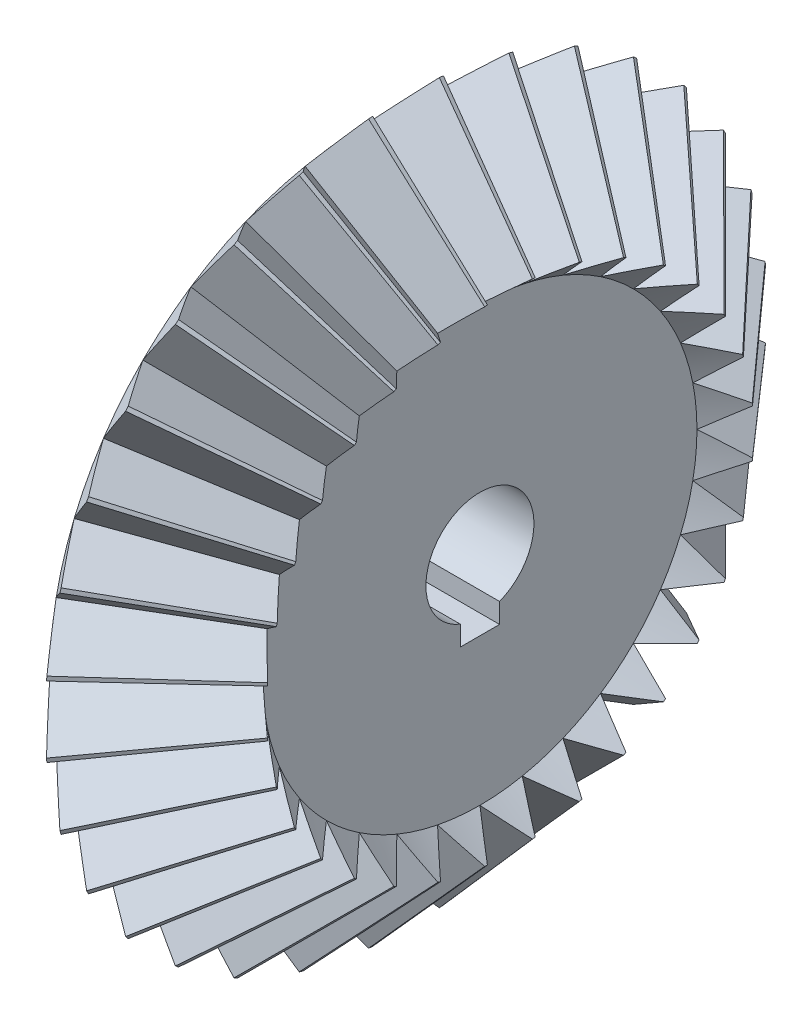
from build123d import *
from build123d.topology import SkipClean

# Parameters (mm, degrees)
SKETCH8_W           = 13.584392644
SKETCH8_H           = 13.584392644
CUT_EXTRUDE3_DEPTH  = 140.683118778
CIRPATTERN2_COUNT   = 32
SKETCH5_R           = 20
BOSS_EXTRUDE2_DEPTH = 12
CUT_EXTRUDE1_DEPTH  = 35


with BuildPart() as part:
    # Sketch1 → Revolve1 (revolve)
    with BuildSketch(Plane(origin=(0, 0, 0), x_dir=(1, 0, 0), z_dir=(0, 1, 0)), mode=Mode.PRIVATE) as revolve1_sk:
        Polygon((0, 0), (23, 0), (23, 44.199151966), (29.109392267, 49.604779092), (7.947696669, 73.521541461), (0, 64.53076187), align=None)
    revolve(revolve1_sk.sketch.rotate(Axis((23, 0, 0), (1, 0, 0)), 180), axis=Axis((23, 0, 0), (1, 0, 0)))

    # Sketch8 → Cut-Extrude3 (cut, through all)
    with SkipClean():  # the faces are left unmerged after this step: merging them gives an invalid solid
        with BuildSketch(Plane(origin=(-32.021593131, 0, -28.30654522), x_dir=(-0.6623080557420813, 0, 0.7492316326071291), z_dir=(-0.7492316326071291, 0, -0.6623080557420813))):
            Polygon((-60.112917194, 6.792196322), (-48.348488069, 0), (-60.112917194, -6.792196322), align=None)
            with Locations((-66.905113516, 0)):
                Rectangle(SKETCH8_W, SKETCH8_H)
        cut_extrude3 = extrude(amount=-CUT_EXTRUDE3_DEPTH, mode=Mode.SUBTRACT)

    # CirPattern2: Cut-Extrude3 ×32 about axis
    cirpattern2_axis = Axis((0, 0, 0), (1, 0, 0))
    for i in range(1, CIRPATTERN2_COUNT):
        add(cut_extrude3.rotate(cirpattern2_axis, i * 360 / CIRPATTERN2_COUNT), mode=Mode.SUBTRACT)

    # Sketch5 → Boss-Extrude2 (add)
    with BuildSketch(Plane.ZY):
        with Locations(Location((0, 0, 0), (0, 0, 180))):
            Circle(SKETCH5_R)
    extrude(amount=BOSS_EXTRUDE2_DEPTH)

    # Sketch6 → Cut-Extrude1 (cut)
    with BuildSketch(Plane.ZY.offset(12)):
        with BuildLine():
            ThreePointArc((11, 0), (-6.204836823, 9.082951062), (-4, -10.246950766))
            Line((-4, -10.246950766), (4, -10.246950766))
            ThreePointArc((4, -10.246950766), (9.082951062, -6.204836823), (11, 0))
        make_face()
        with BuildLine():
            Line((4, -10.246950766), (-4, -10.246950766))
            ThreePointArc((-4, -10.246950766), (0, -11), (4, -10.246950766))
        make_face()
        with BuildLine():
            ThreePointArc((4, -10.246950766), (0, -11), (-4, -10.246950766))
            Line((-4, -10.246950766), (-4, -14.3))
            Line((-4, -14.3), (4, -14.3))
            Line((4, -14.3), (4, -10.246950766))
        make_face()
    extrude(amount=-CUT_EXTRUDE1_DEPTH, mode=Mode.SUBTRACT)


solid = part.part
